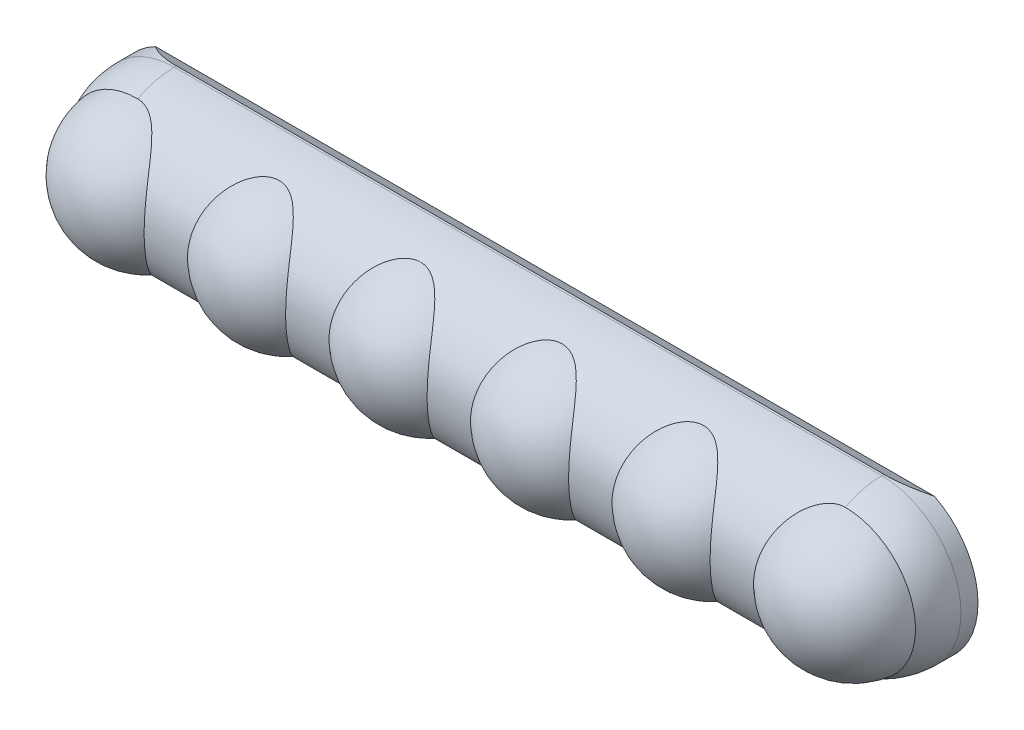
from build123d import *

# Parameters (mm, degrees)
REVOLVE1_ANGLE          = 180
REVOLVE2_ANGLE          = 180
LPATTERN1_COUNT         = 6
LPATTERN1_PITCH         = 25
BOSS_EXTRUDE1_DEPTH     = 3
CUT_EXTRUDE4_DEPTH      = 80.715117781
CUT_EXTRUDE4_DEPTH_BACK = 80.715117781
SKETCH6_R               = 2.6
CUT_EXTRUDE5_DEPTH      = 8
SKETCH7_W               = 46.5
SKETCH7_H               = 12
CUT_EXTRUDE6_DEPTH      = 8


with BuildPart() as part:
    # Sketch1 → Revolve1 (revolve)
    with BuildSketch(Plane.XY):
        with BuildLine():
            Line((62.5, 14), (-62.5, 14))
            ThreePointArc((-62.5, 14), (-72.399494937, 9.899494937), (-76.5, 0))
            Line((-76.5, 0), (76.5, 0))
            ThreePointArc((76.5, 0), (72.399494937, 9.899494937), (62.5, 14))
        make_face()
    revolve(axis=Axis((-76.5, 0, 0), (1, 0, 0)), revolution_arc=REVOLVE1_ANGLE)

    # Sketch3 → Revolve2 (revolve)
    with BuildSketch(Plane.XY.offset(5)):
        with BuildLine():
            Line((-75, 0), (-50, 0))
            ThreePointArc((-50, 0), (-62.5, 12.5), (-75, 0))
        make_face()
    revolve2 = revolve(axis=Axis((-75, 0, 5), (1, 0, 0)), revolution_arc=REVOLVE2_ANGLE)

    # LPattern1: Revolve2 ×6
    with Locations(*[(i * LPATTERN1_PITCH, 0, 0) for i in range(1, LPATTERN1_COUNT)]):
        add(revolve2)

    # Sketch4 → Boss-Extrude1 (add)
    with BuildSketch(Plane(origin=(0, 0, 0), x_dir=(-1, 0, 0), z_dir=(0, 0, -1))):
        with BuildLine():
            Line((-62.5, -14), (62.5, -14))
            ThreePointArc((62.5, -14), (76.5, 0), (62.5, 14))
            Line((62.5, 14), (-62.5, 14))
            ThreePointArc((-62.5, 14), (-76.5, 0), (-62.5, -14))
        make_face()
    extrude(amount=BOSS_EXTRUDE1_DEPTH)

    # Sketch5 → Cut-Extrude4 (cut, two sides: drawn at the far end of the back side and taken through both)
    with BuildSketch(Plane(origin=(0, 0, 0), x_dir=(0, 0, -1), z_dir=(1, 0, 0)).offset(-CUT_EXTRUDE4_DEPTH_BACK)):
        Polygon((0.398662505, 13.994322713), (0.398662505, 14.646589276), (3, 14.646589276), (3, 12.5), align=None)
        Polygon((3, -14), (0.398662505, -14), (3, -12.5), align=None)
    extrude(amount=CUT_EXTRUDE4_DEPTH + CUT_EXTRUDE4_DEPTH_BACK, mode=Mode.SUBTRACT)

    # Sketch6 → Cut-Extrude5 (cut)
    with BuildSketch(Plane(origin=(0, 0, -3), x_dir=(-1, 0, 0), z_dir=(0, 0, -1))):
        with Locations(Location((0, 0, 0), (0, 0, 90))):
            Circle(SKETCH6_R)
        with Locations(Location((62.5, 0, 0), (0, 0, 90))):
            Circle(SKETCH6_R)
        with Locations(Location((-62.5, 0, 0), (0, 0, 90))):
            Circle(SKETCH6_R)
    extrude(amount=-CUT_EXTRUDE5_DEPTH, mode=Mode.SUBTRACT)

    # Sketch7 → Cut-Extrude6 (cut)
    with BuildSketch(Plane(origin=(0, 0, -3), x_dir=(-1, 0, 0), z_dir=(0, 0, -1))):
        with Locations((-31.25, 0)):
            Rectangle(SKETCH7_W, SKETCH7_H)
        with Locations((31.25, 0)):
            Rectangle(SKETCH7_W, SKETCH7_H)
    extrude(amount=-CUT_EXTRUDE6_DEPTH, mode=Mode.SUBTRACT)


solid = part.part
